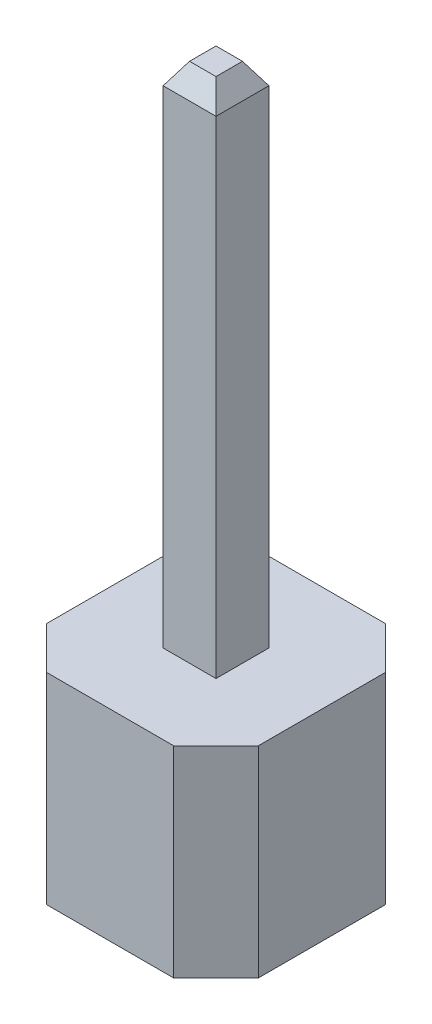
from build123d import *
from OCP.BRepFilletAPI import BRepFilletAPI_MakeChamfer

# Parameters (mm, degrees)
SKETCH1_W           = 2.54
SKETCH1_H           = 2.54
BOSS_EXTRUDE1_DEPTH = 2.413
CHAMFER1_SIZE       = 0.508
SKETCH2_W           = 0.635
SKETCH2_H           = 0.635
BOSS_EXTRUDE2_DEPTH = 6.096
CHAMFER2_SIZE       = 0.254
CHAMFER2_SIZE2      = 0.158716815


with BuildPart() as part:
    # Sketch1 → Boss-Extrude1 (new body)
    with BuildSketch(Plane(origin=(0, 0, 0), x_dir=(1, 0, 0), z_dir=(0, 1, 0))):
        Rectangle(SKETCH1_W, SKETCH1_H)
    extrude(amount=BOSS_EXTRUDE1_DEPTH)

    # Chamfer1
    chamfer1_edges = [part.edges().sort_by_distance(p)[0] for p in [
        (1.27, 1.2065, 1.27),
        (-1.27, 1.2065, 1.27),
        (-1.27, 1.2065, -1.27),
        (1.27, 1.2065, -1.27),
    ]]
    chamfer(chamfer1_edges, length=CHAMFER1_SIZE)

    # Sketch2 → Boss-Extrude2 (add)
    with BuildSketch(Plane(origin=(0, 2.413, 0), x_dir=(1, 0, 0), z_dir=(0, 1, 0))):
        Rectangle(SKETCH2_W, SKETCH2_H)
    extrude(amount=BOSS_EXTRUDE2_DEPTH)

    # Chamfer2: one chamfer whose edges measure the first distance from different faces: ONE call of the kernel's chamfer builder (chamfer() names one face for all edges)
    chamfer2_edges_1 = [part.edges().sort_by_distance(p)[0] for p in [
        (0.3175, 8.509, 0),
    ]]
    chamfer2_side_1 = [part.faces().sort_by_distance(p)[0] for p in [
        (0.3175, 5.461, 0),
    ]]
    chamfer2_edges_2 = [part.edges().sort_by_distance(p)[0] for p in [
        (0, 8.509, -0.3175),
    ]]
    chamfer2_side_2 = [part.faces().sort_by_distance(p)[0] for p in [
        (0, 5.461, -0.3175),
    ]]
    chamfer2_edges_3 = [part.edges().sort_by_distance(p)[0] for p in [
        (-0.3175, 8.509, 0),
    ]]
    chamfer2_side_3 = [part.faces().sort_by_distance(p)[0] for p in [
        (-0.3175, 5.461, 0),
    ]]
    chamfer2_edges_4 = [part.edges().sort_by_distance(p)[0] for p in [
        (0, 8.509, 0.3175),
    ]]
    chamfer2_side_4 = [part.faces().sort_by_distance(p)[0] for p in [
        (0, 5.461, 0.3175),
    ]]
    chamfer2 = BRepFilletAPI_MakeChamfer(part.part.solid().wrapped)
    for e in chamfer2_edges_1:
        chamfer2.Add(CHAMFER2_SIZE, CHAMFER2_SIZE2, e.wrapped, chamfer2_side_1[0].wrapped)  # the first distance lies on this face
    for e in chamfer2_edges_2:
        chamfer2.Add(CHAMFER2_SIZE, CHAMFER2_SIZE2, e.wrapped, chamfer2_side_2[0].wrapped)  # the first distance lies on this face
    for e in chamfer2_edges_3:
        chamfer2.Add(CHAMFER2_SIZE, CHAMFER2_SIZE2, e.wrapped, chamfer2_side_3[0].wrapped)  # the first distance lies on this face
    for e in chamfer2_edges_4:
        chamfer2.Add(CHAMFER2_SIZE, CHAMFER2_SIZE2, e.wrapped, chamfer2_side_4[0].wrapped)  # the first distance lies on this face
    add(Compound.cast(chamfer2.Shape()), mode=Mode.REPLACE)


solid = part.part
